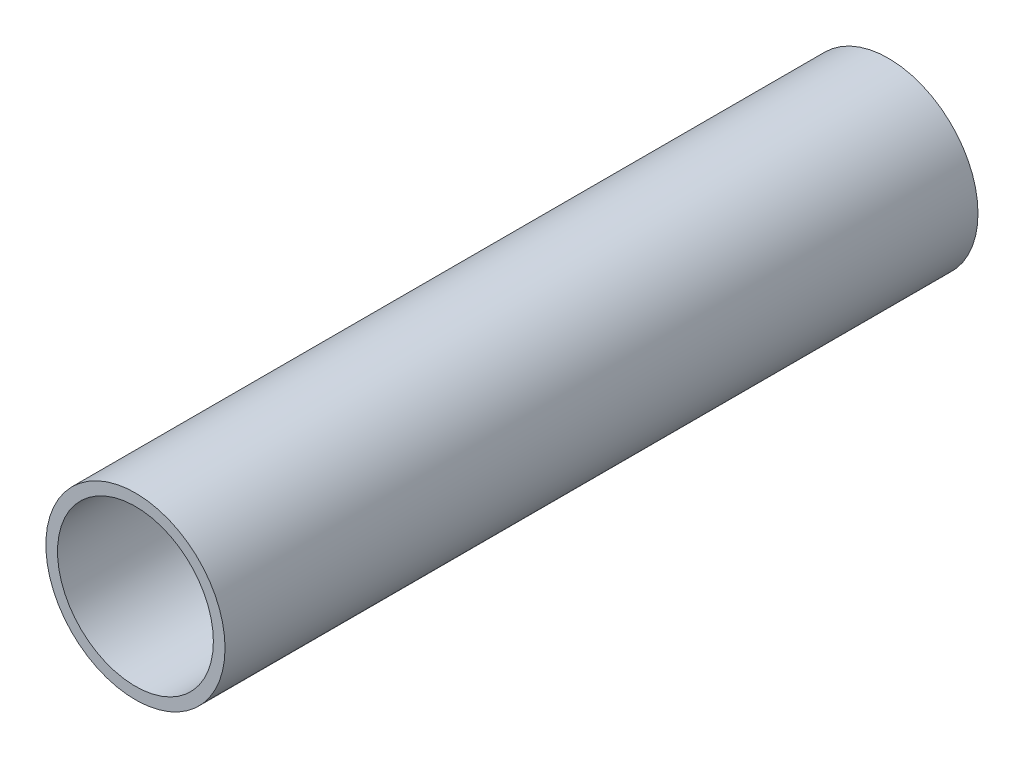
from build123d import *

# Parameters (mm, degrees)
SKETCH1_R           = 30.226
SKETCH1_R_2         = 26.289
BOSS_EXTRUDE1_DEPTH = 254


with BuildPart() as part:
    # Sketch1 → Boss-Extrude1 (new body)
    with BuildSketch(Plane.XY):
        Circle(SKETCH1_R)
        Circle(SKETCH1_R_2, mode=Mode.SUBTRACT)
    extrude(amount=BOSS_EXTRUDE1_DEPTH)


solid = part.part
